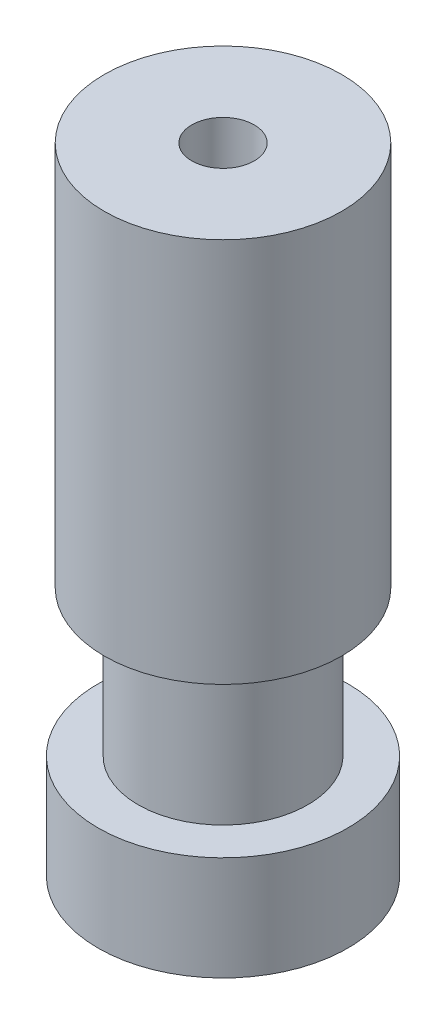
from build123d import *

# Parameters (mm, degrees)
SKETCH1_R                 = 6
BOSS_EXTRUDE1_DEPTH       = 5
CUT_EXTRUDE1_DEPTH        = 3
SKETCH3_R                 = 4.075
BOSS_EXTRUDE2_DEPTH       = 7
SKETCH4_R                 = 5.7
BOSS_EXTRUDE3_DEPTH       = 18.5
F_1_0MM_DOWEL_HOLE1_D     = 3
F_1_0MM_DOWEL_HOLE1_DEPTH = 30.5
F_1_0MM_DOWEL_HOLE1_TIP   = 0.901290929


with BuildPart() as part:
    # Sketch1 → Boss-Extrude1 (new body)
    with BuildSketch(Plane(origin=(0, 0, 0), x_dir=(1, 0, 0), z_dir=(0, 1, 0))):
        with Locations(Location((0, 0, 0), (0, 0, 270))):
            Circle(SKETCH1_R)
    extrude(amount=BOSS_EXTRUDE1_DEPTH)

    # Sketch2 → Cut-Extrude1 (cut)
    with BuildSketch(Plane.XZ):
        Polygon((3.233161507, 0), (1.616580754, 2.8), (-1.616580754, 2.8), (-3.233161507, 0), (-1.616580754, -2.8), (1.616580754, -2.8), align=None)
    extrude(amount=-CUT_EXTRUDE1_DEPTH, mode=Mode.SUBTRACT)

    # Sketch3 → Boss-Extrude2 (add)
    with BuildSketch(Plane(origin=(0, 5, 0), x_dir=(1, 0, 0), z_dir=(0, 1, 0))):
        with Locations(Location((0, 0, 0), (0, 0, 270))):
            Circle(SKETCH3_R)
    extrude(amount=BOSS_EXTRUDE2_DEPTH)

    # Sketch4 → Boss-Extrude3 (add)
    with BuildSketch(Plane(origin=(0, 12, 0), x_dir=(1, 0, 0), z_dir=(0, 1, 0))):
        with Locations(Location((0, 0, 0), (0, 0, 270))):
            Circle(SKETCH4_R)
    extrude(amount=BOSS_EXTRUDE3_DEPTH)

    # Ø1.0mm Dowel Hole1
    with Locations(Plane(origin=(0, 30.5, 0), x_dir=(1, 0, 0), z_dir=(0, 1, 0))):
        with Locations((0, 0)):
            Hole(F_1_0MM_DOWEL_HOLE1_D / 2, depth=F_1_0MM_DOWEL_HOLE1_DEPTH)
            with Locations((0, 0, -(F_1_0MM_DOWEL_HOLE1_DEPTH + F_1_0MM_DOWEL_HOLE1_TIP / 2))):  # 118° drill point
                Cone(0, F_1_0MM_DOWEL_HOLE1_D / 2, F_1_0MM_DOWEL_HOLE1_TIP, mode=Mode.SUBTRACT)


solid = part.part
